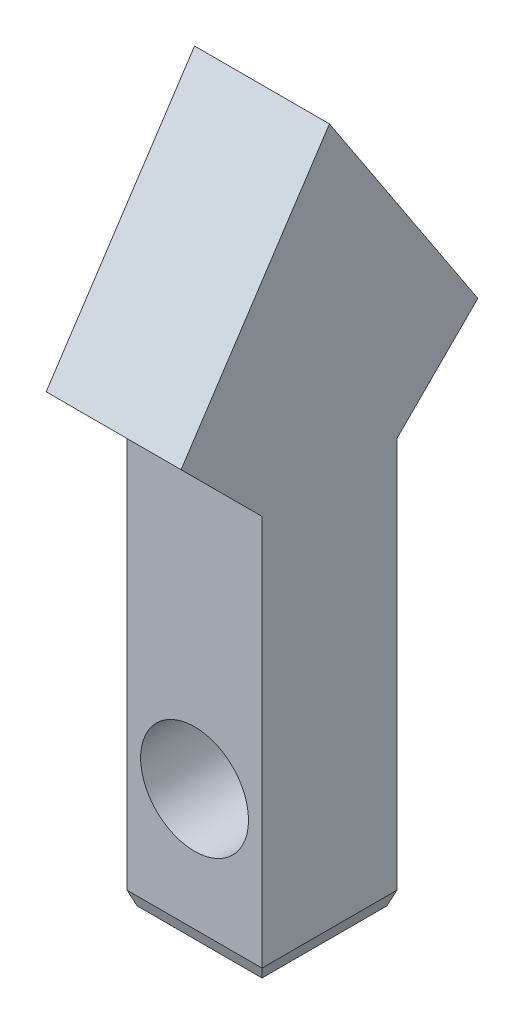
from build123d import *
from OCP.BRepFilletAPI import BRepFilletAPI_MakeChamfer

# Parameters (mm, degrees)
BOSS_EXTRUDE1_DEPTH = 5
SKETCH4_R           = 2
CUT_EXTRUDE2_DEPTH  = 10
CHAMFER1_SIZE       = 0.5
CHAMFER1_SIZE2      = 0.181985117


with BuildPart() as part:
    # Sketch2 → Boss-Extrude1 (new body)
    with BuildSketch(Plane.YZ):
        Polygon((-3, 8), (-13, 8), (-13, 3), (-3, 3), (2, 3), (5, 0), (13.351646544, 5.5), (5, 11), (2, 8), align=None)
    extrude(amount=BOSS_EXTRUDE1_DEPTH)

    # Sketch4 → Cut-Extrude2 (cut)
    with BuildSketch(Plane.XY.offset(8)):
        with Locations((2.5, -8)):
            Circle(SKETCH4_R)
    extrude(amount=-CUT_EXTRUDE2_DEPTH, mode=Mode.SUBTRACT)

    # Chamfer1: one chamfer whose edges measure the first distance from different faces: ONE call of the kernel's chamfer builder (chamfer() names one face for all edges)
    chamfer1_edges_1 = [part.edges().sort_by_distance(p)[0] for p in [
        (0, -13, 5.5),
    ]]
    chamfer1_side_1 = [part.faces().sort_by_distance(p)[0] for p in [
        (0, 0.23145202, 5.5),
    ]]
    chamfer1_edges_2 = [part.edges().sort_by_distance(p)[0] for p in [
        (2.5, -13, 3),
    ]]
    chamfer1_side_2 = [part.faces().sort_by_distance(p)[0] for p in [
        (2.5, -4.996810824, 3),
    ]]
    chamfer1_edges_3 = [part.edges().sort_by_distance(p)[0] for p in [
        (2.5, -13, 8),
    ]]
    chamfer1_side_3 = [part.faces().sort_by_distance(p)[0] for p in [
        (2.5, -4.996810824, 8),
    ]]
    chamfer1_edges_4 = [part.edges().sort_by_distance(p)[0] for p in [
        (5, -13, 5.5),
    ]]
    chamfer1_side_4 = [part.faces().sort_by_distance(p)[0] for p in [
        (5, 0.23145202, 5.5),
    ]]
    chamfer1 = BRepFilletAPI_MakeChamfer(part.part.solid().wrapped)
    for e in chamfer1_edges_1:
        chamfer1.Add(CHAMFER1_SIZE, CHAMFER1_SIZE2, e.wrapped, chamfer1_side_1[0].wrapped)  # the first distance lies on this face
    for e in chamfer1_edges_2:
        chamfer1.Add(CHAMFER1_SIZE, CHAMFER1_SIZE2, e.wrapped, chamfer1_side_2[0].wrapped)  # the first distance lies on this face
    for e in chamfer1_edges_3:
        chamfer1.Add(CHAMFER1_SIZE, CHAMFER1_SIZE2, e.wrapped, chamfer1_side_3[0].wrapped)  # the first distance lies on this face
    for e in chamfer1_edges_4:
        chamfer1.Add(CHAMFER1_SIZE, CHAMFER1_SIZE2, e.wrapped, chamfer1_side_4[0].wrapped)  # the first distance lies on this face
    add(Compound.cast(chamfer1.Shape()), mode=Mode.REPLACE)


solid = part.part
